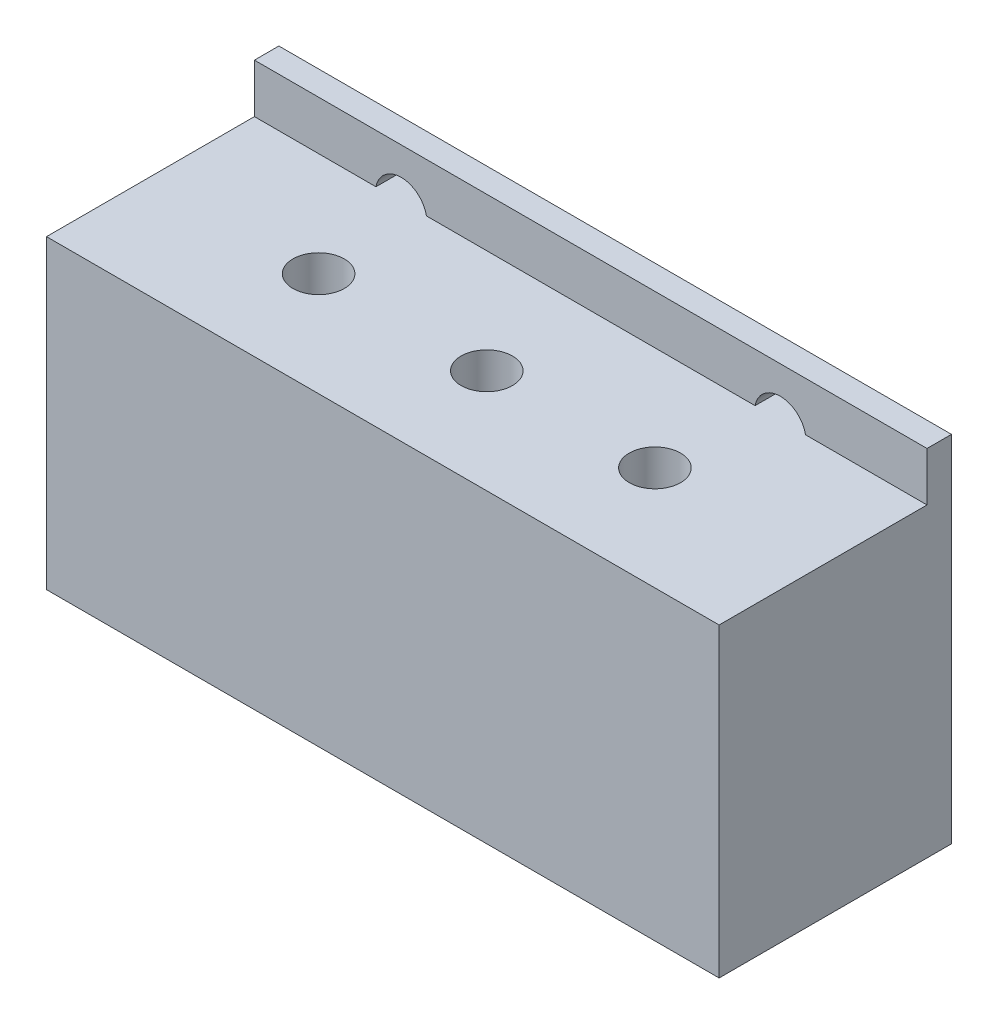
from build123d import *

# Parameters (mm, degrees)
ESQUISSE1_W             = 275
ESQUISSE1_H             = 145
ESQUISSE1_R             = 10.5
ESQUISSE1_R_2           = 8
BOSS_EXTRU_1_DEPTH      = 10
ESQUISSE2_W             = 275
ESQUISSE2_H             = 95
BOSS_EXTRU_2_DEPTH      = 125
ESQUISSE4_R             = 10.5
ENL_V_MAT_EXTRU_1_DEPTH = 317.662280671


with BuildPart() as part:
    # Esquisse1 → Boss.-Extru.1 (new body)
    with BuildSketch(Plane.XY):
        with Locations((137.5, 72.5)):
            Rectangle(ESQUISSE1_W, ESQUISSE1_H)
        with Locations((60, 123)):
            Circle(ESQUISSE1_R, mode=Mode.SUBTRACT)
        with Locations((25, 85)):
            Circle(ESQUISSE1_R_2, mode=Mode.SUBTRACT)
        with Locations(Location((250, 85, 0), (0, 0, 180))):
            Circle(ESQUISSE1_R_2, mode=Mode.SUBTRACT)
        with Locations(Location((215, 123, 0), (0, 0, 180))):
            Circle(ESQUISSE1_R, mode=Mode.SUBTRACT)
    extrude(amount=BOSS_EXTRU_1_DEPTH)

    # Esquisse2 → Boss.-Extru.2 (add)
    with BuildSketch(Plane(origin=(0, 0, 0), x_dir=(1, 0, 0), z_dir=(0, 1, 0))):
        with Locations((137.5, -47.5)):
            Rectangle(ESQUISSE2_W, ESQUISSE2_H)
    extrude(amount=BOSS_EXTRU_2_DEPTH)

    # Esquisse4 → Enlèv. mat.-Extru.1 (cut, through all)
    with BuildSketch(Plane(origin=(0, 125, 0), x_dir=(1, 0, 0), z_dir=(0, 1, 0))):
        with Locations(Location((206.25, -52.5, 0), (0, 0, 270))):
            Circle(ESQUISSE4_R)
        with Locations(Location((137.5, -52.5, 0), (0, 0, 270))):
            Circle(ESQUISSE4_R)
        with Locations(Location((68.75, -52.5, 0), (0, 0, 270))):
            Circle(ESQUISSE4_R)
    extrude(amount=-ENL_V_MAT_EXTRU_1_DEPTH, mode=Mode.SUBTRACT)


solid = part.part
